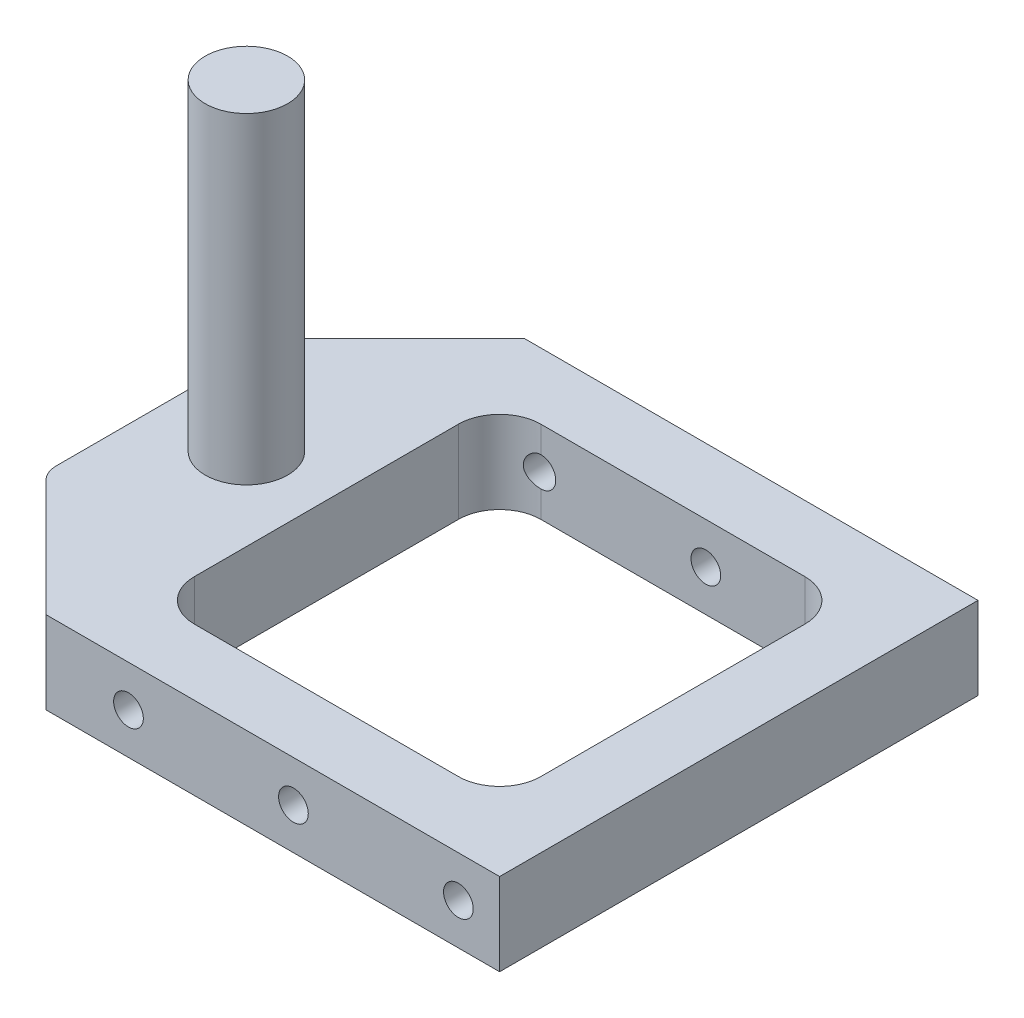
from build123d import *

# Parameters (mm, degrees)
SKETCH1_W          = 70
SKETCH1_H          = 10
EXTRUDE1_DEPTH     = 58
SKETCH2_R          = 5
EXTRUDE2_DEPTH     = 49
CUT_EXTRUDE1_DEPTH = 30
CHAMFER1_SIZE      = 15
FILLET1_R          = 3
SKETCH4_R          = 1.8
CUT_EXTRUDE2_DEPTH = 60


with BuildPart() as part:
    # Sketch1 → Extrude1 (new body)
    with BuildSketch(Plane.XY):
        with Locations((-10.032216865, -100)):
            Rectangle(SKETCH1_W, SKETCH1_H)
    extrude(amount=EXTRUDE1_DEPTH)

    # Sketch2 → Extrude2 (add)
    with BuildSketch(Plane.XZ.offset(105)):
        with Locations((-35.032216865, 28.7)):
            Circle(SKETCH2_R)
    extrude(amount=-EXTRUDE2_DEPTH)

    # Sketch3 → Cut-Extrude1 (cut)
    with BuildSketch(Plane.XZ.offset(105)):
        with BuildLine():
            Line((-20.032216865, 50), (11.967783135, 50))
            ThreePointArc((11.967783135, 50), (15.503317041, 48.535533906), (16.967783135, 45))
            Line((16.967783135, 45), (16.967783135, 13))
            ThreePointArc((16.967783135, 13), (15.503317041, 9.464466094), (11.967783135, 8))
            Line((11.967783135, 8), (-20.032216865, 8))
            ThreePointArc((-20.032216865, 8), (-23.567750771, 9.464466094), (-25.032216865, 13))
            Line((-25.032216865, 13), (-25.032216865, 45))
            ThreePointArc((-25.032216865, 45), (-23.567750771, 48.535533906), (-20.032216865, 50))
        make_face()
    extrude(amount=-CUT_EXTRUDE1_DEPTH, mode=Mode.SUBTRACT)

    # Chamfer1
    chamfer1_edges = [part.edges().sort_by_distance(p)[0] for p in [
        (-45.032216865, -100, 58),
        (-45.032216865, -100, 0),
    ]]
    chamfer(chamfer1_edges, length=CHAMFER1_SIZE)

    # Fillet1
    fillet1_edges = [part.edges().sort_by_distance(p)[0] for p in [
        (-45.032216865, -100, 43),
        (-45.032216865, -100, 15),
    ]]
    fillet(fillet1_edges, radius=FILLET1_R)

    # Sketch4 → Cut-Extrude2 (cut)
    with BuildSketch(Plane.XY.offset(58)):
        with Locations((-20.032216865, -100)):
            Circle(SKETCH4_R)
        with Locations((-0.032216865, -100)):
            Circle(SKETCH4_R)
        with Locations((19.967783135, -100)):
            Circle(SKETCH4_R)
    extrude(amount=-CUT_EXTRUDE2_DEPTH, mode=Mode.SUBTRACT)


solid = part.part
